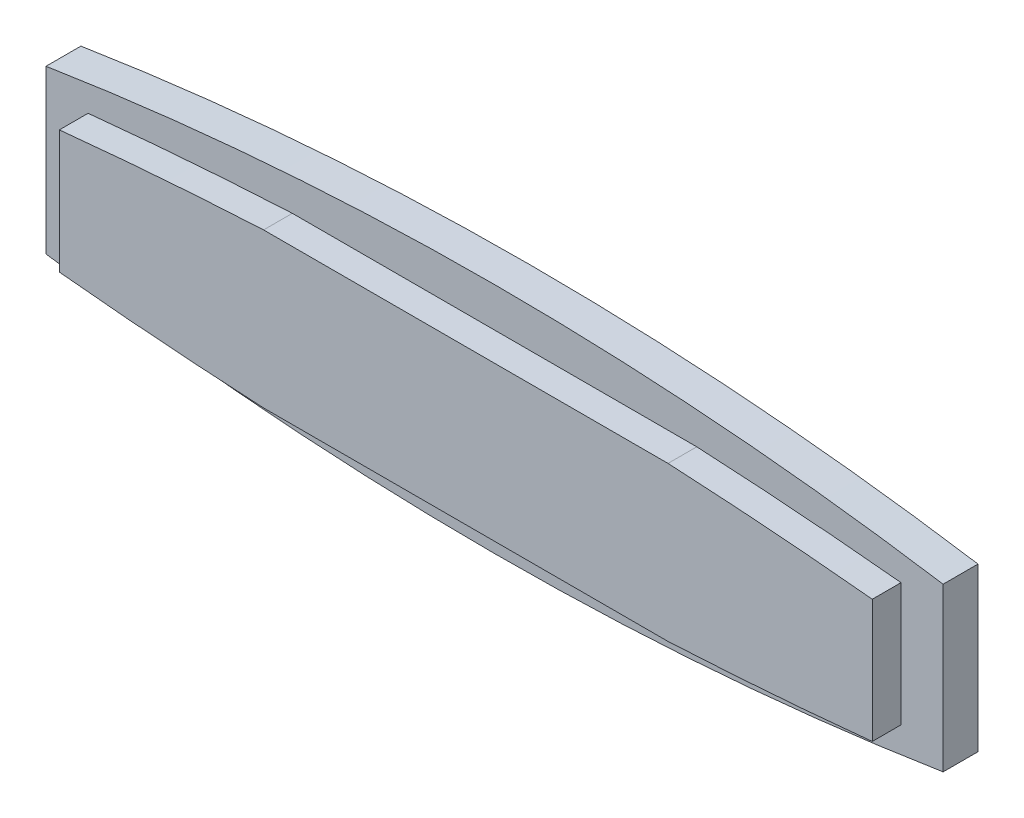
from build123d import *

# Parameters (mm, degrees)
SKETCH_1_W          = 43.7
SKETCH_1_H          = 11.35
EXTRUDE_1_DEPTH     = 1.7
SKETCH_2_OUTSIDE_W  = 54.736
SKETCH_2_OUTSIDE_H  = 22.386
CUT_EXTRUDE_3_DEPTH = 23.638863156
EXTRUDE_4_DEPTH     = 1.4


with BuildPart() as part:
    # Эскиз1 → Вытянуть1 (new body)
    with BuildSketch(Plane.XY):
        Rectangle(SKETCH_1_W, SKETCH_1_H)
    extrude(amount=EXTRUDE_1_DEPTH)

    # Эскиз2 outside → Вытянуть3 (cut, through all)
    with BuildSketch(Plane.XY.offset(1.7)):
        Rectangle(SKETCH_2_OUTSIDE_W, SKETCH_2_OUTSIDE_H)
        with BuildLine():
            ThreePointArc((39.456233665, 0), (0, 5.675), (-39.456233665, 0))
            ThreePointArc((-39.456233665, 0), (0, -5.675), (39.456233665, 0))
        make_face(mode=Mode.SUBTRACT)
    extrude(amount=-CUT_EXTRUDE_3_DEPTH, mode=Mode.SUBTRACT)

    # Эскиз3 → Вытянуть4 (add)
    with BuildSketch(Plane.XY.offset(1.7)):
        with BuildLine():
            Line((-9.85, 3.755003836), (9.85, 3.755003836))
            ThreePointArc((9.85, 3.755003836), (14.829805552, 3.440833038), (19.8, 3))
            Line((19.8, 3), (19.8, -3))
            ThreePointArc((19.8, -3), (14.829805552, -3.440833038), (9.85, -3.755003836))
            Line((9.85, -3.755003836), (-9.85, -3.755003836))
            ThreePointArc((-9.85, -3.755003836), (-14.829805552, -3.440833038), (-19.8, -3))
            Line((-19.8, -3), (-19.8, 3))
            ThreePointArc((-19.8, 3), (-14.829805552, 3.440833038), (-9.85, 3.755003836))
        make_face()
    extrude(amount=EXTRUDE_4_DEPTH)


solid = part.part
